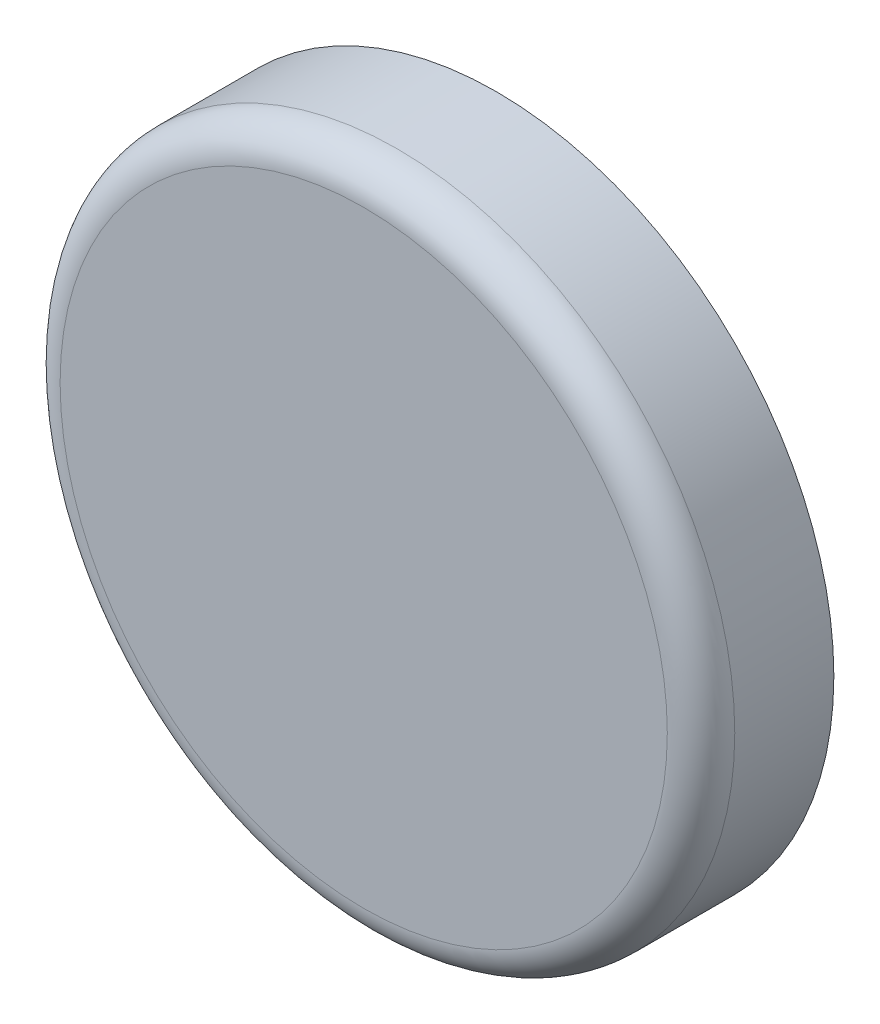
from build123d import *

# Parameters (mm, degrees)
SKETCH1_R           = 12.7
BOSS_EXTRUDE1_DEPTH = 5
SKETCH3_R           = 1.5
BOSS_EXTRUDE2_DEPTH = 6.35
FILLET1_R           = 1.27


with BuildPart() as part:
    # Sketch1 → Boss-Extrude1 (new body)
    with BuildSketch(Plane.XY):
        Circle(SKETCH1_R)
    extrude(amount=BOSS_EXTRUDE1_DEPTH)

    # Sketch3 → Boss-Extrude2 (add)
    with BuildSketch(Plane(origin=(0, 0, 0), x_dir=(-1, 0, 0), z_dir=(0, 0, -1))):
        with Locations(Location((0, 0, 0), (0, 0, 180))):
            Circle(SKETCH3_R)
    extrude(amount=BOSS_EXTRUDE2_DEPTH)

    # Fillet1
    fillet1_edges = [part.edges().sort_by_distance(p)[0] for p in [
        (-12.7, 0, 5),
    ]]
    fillet(fillet1_edges, radius=FILLET1_R)


solid = part.part
